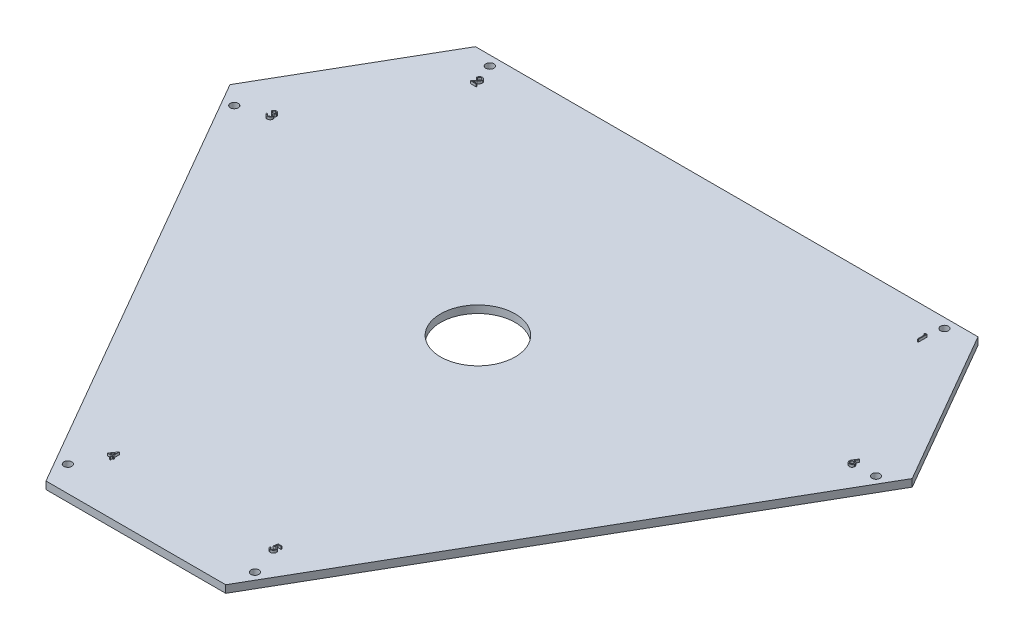
from build123d import *

# Parameters (mm, degrees)
SKETCH1_R           = 15
SKETCH1_R_2         = 1.6
BOSS_EXTRUDE1_DEPTH = 3
BOSS_EXTRUDE2_DEPTH = 1


with BuildPart() as part:
    # Sketch1 → Boss-Extrude1 (new body)
    with BuildSketch(Plane(origin=(0, 0, 0), x_dir=(1, 0, 0), z_dir=(0, 1, 0))):
        Polygon((100.985180782, 100), (-100.985180782, 100), (-137.095130769, 37.455731963), (-36.109949988, -137.455731963), (36.109949988, -137.455731963), (137.095130769, 37.455731963), align=None)
        with Locations(Location((0, 0, 0), (0, 0, 270))):
            Circle(SKETCH1_R, mode=Mode.SUBTRACT)
        with Locations(Location((91.352776846, 96.15, 0), (0, 0, 270))):
            Circle(SKETCH1_R_2, mode=Mode.SUBTRACT)
        with Locations(Location((128.944730997, 31.038825455, 0), (0, 0, 90))):
            Circle(SKETCH1_R_2, mode=Mode.SUBTRACT)
        with Locations(Location((37.591954151, -127.188825455, 0), (0, 0, 270))):
            Circle(SKETCH1_R_2, mode=Mode.SUBTRACT)
        with Locations(Location((-37.591954151, -127.188825455, 0), (0, 0, 90))):
            Circle(SKETCH1_R_2, mode=Mode.SUBTRACT)
        with Locations(Location((-128.944730997, 31.038825455, 0), (0, 0, 270))):
            Circle(SKETCH1_R_2, mode=Mode.SUBTRACT)
        with Locations(Location((-91.352776846, 96.15, 0), (0, 0, 90))):
            Circle(SKETCH1_R_2, mode=Mode.SUBTRACT)
    extrude(amount=BOSS_EXTRUDE1_DEPTH)

    # Sketch2 → Boss-Extrude2 (add)
    # profile 1 of 6: a face of its own
    with BuildSketch(Plane(origin=(0, 3, 0), x_dir=(1, 0, 0), z_dir=(0, 1, 0))):
        Polygon((90.231282455, 89.65), (90.878417872, 89.65), (90.878417872, 86.15), (90.564315308, 86.15), (90.564315308, 89.291025641), (90.025853769, 89.291025641), align=None)
    # profile 2 of 6: a face of its own
    with BuildSketch(Plane(origin=(0, 3, 0), x_dir=(1, 0, 0), z_dir=(0, 1, 0))):
        with BuildLine():
            Line((-88.769443513, 88.573076923), (-89.083546077, 88.573076923))
            add(Edge.make_bspline(
                [(-89.083546077, 88.573076923), (-89.081498924, 88.614747811), (-89.07747837, 88.696588325), (-89.058650081, 88.815912232), (-89.031709204, 88.929967031), (-88.99361775, 89.037836945), (-88.946311472, 89.140475752), (-88.889581444, 89.237475767), (-88.822387594, 89.328466956), (-88.74618086, 89.412605799), (-88.663412221, 89.48979337), (-88.574106281, 89.556448613), (-88.480261254, 89.612766284), (-88.382161855, 89.659847526), (-88.278701291, 89.695187372), (-88.170818434, 89.721409012), (-88.058039297, 89.737185357), (-87.981199275, 89.738881143), (-87.942119795, 89.73974359)],
                knots=[0, 0, 0, 0, 1.10065271, 2.161652631, 3.183658789, 4.190468796, 5.17591951, 6.163126047, 7.15150782, 8.156236427, 9.156009102, 10.134482811, 11.092018607, 12.041330605, 13.001268258, 13.972401359, 14.968799086, 16, 16, 16, 16], degree=3))
            add(Edge.make_bspline(
                [(-87.942119795, 89.73974359), (-87.903741721, 89.738845133), (-87.828330176, 89.737079698), (-87.718268162, 89.721918669), (-87.613490867, 89.698173078), (-87.514203101, 89.664857661), (-87.421197036, 89.620073234), (-87.333773992, 89.566275695), (-87.250893181, 89.504055864), (-87.176286397, 89.43080205), (-87.107778318, 89.352599666), (-87.048676063, 89.269111762), (-86.998062899, 89.182882477), (-86.95587522, 89.093254275), (-86.924819081, 88.999383247), (-86.901240873, 88.902636044), (-86.887913459, 88.802011233), (-86.885868035, 88.733904677), (-86.884828128, 88.699278846)],
                knots=[0, 0, 0, 0, 1.111607364, 2.184268762, 3.212621178, 4.221274766, 5.211760367, 6.196651075, 7.1921475, 8.207485113, 9.220403448, 10.201281604, 11.166441695, 12.114753415, 13.065576456, 14.026450734, 14.996634279, 16, 16, 16, 16], degree=3))
            add(Edge.make_bspline(
                [(-86.884828128, 88.699278846), (-86.886521391, 88.650531012), (-86.889878203, 88.553890798), (-86.918592579, 88.411875935), (-86.96343909, 88.274282516), (-87.017436447, 88.163545214), (-87.071908891, 88.07431172), (-87.120996399, 88.000843015), (-87.17846121, 87.921737547), (-87.245139708, 87.83726021), (-87.31965258, 87.746749304), (-87.402674743, 87.650259509), (-87.494798225, 87.548787739), (-87.559456726, 87.479482138), (-87.592961141, 87.443569712)],
                knots=[0, 0, 0, 0, 1.184426356, 2.348067706, 3.509069118, 4.696110526, 5.333549288, 6.050745305, 6.844228056, 7.710549037, 8.667450064, 9.695053472, 10.805634456, 12, 12, 12, 12], degree=3))
            Line((-87.592961141, 87.443569712), (-88.468662263, 86.508974359))
            Line((-88.468662263, 86.508974359), (-86.839956333, 86.508974359))
            Line((-86.839956333, 86.508974359), (-86.839956333, 86.15))
            Line((-86.839956333, 86.15), (-89.218161462, 86.15))
            Line((-89.218161462, 86.15), (-87.860789667, 87.598517628))
            add(Edge.make_bspline(
                [(-87.860789667, 87.598517628), (-87.82774178, 87.633015935), (-87.764263553, 87.699280121), (-87.674480976, 87.796023081), (-87.593841988, 87.885772622), (-87.521824595, 87.968359171), (-87.45999109, 88.044990738), (-87.405118858, 88.113185442), (-87.361153267, 88.175939892), (-87.313437871, 88.248680506), (-87.26722389, 88.337492823), (-87.227511534, 88.446026513), (-87.203296685, 88.557753765), (-87.20039185, 88.633255802), (-87.198930692, 88.671233974)],
                knots=[0, 0, 0, 0, 1.329631726, 2.553950428, 3.673215718, 4.687767853, 5.603093632, 6.413772471, 7.123043292, 7.734684054, 8.834405432, 9.900288307, 10.943827018, 12, 12, 12, 12], degree=3))
            add(Edge.make_bspline(
                [(-87.198930692, 88.671233974), (-87.199566435, 88.695115373), (-87.200819361, 88.742181023), (-87.211877058, 88.811186782), (-87.228587564, 88.877751596), (-87.252532822, 88.942080215), (-87.284139562, 89.003525867), (-87.322612942, 89.062163347), (-87.367003006, 89.118852313), (-87.418354275, 89.172005611), (-87.474765795, 89.220686816), (-87.534360044, 89.263810902), (-87.597410149, 89.299850012), (-87.663650271, 89.329393509), (-87.73289574, 89.352568891), (-87.805280485, 89.36862747), (-87.880604502, 89.378709954), (-87.932037997, 89.380074126), (-87.958245596, 89.380769231)],
                knots=[0, 0, 0, 0, 0.991446411, 1.95395049, 2.89581595, 3.838931463, 4.798493298, 5.75982156, 6.748411868, 7.785213223, 8.824556874, 9.840280684, 10.836137867, 11.835679398, 12.848801643, 13.863922112, 14.911575587, 16, 16, 16, 16], degree=3))
            add(Edge.make_bspline(
                [(-87.958245596, 89.380769231), (-87.985616429, 89.380054199), (-88.039368225, 89.378649993), (-88.118287258, 89.368827329), (-88.193573036, 89.351881489), (-88.265414939, 89.328704814), (-88.333934524, 89.299246266), (-88.398798569, 89.262554521), (-88.459861458, 89.218771028), (-88.517237981, 89.169130471), (-88.57010196, 89.11386287), (-88.616548836, 89.052252907), (-88.65713285, 88.985425492), (-88.692542084, 88.913560941), (-88.721297774, 88.836007161), (-88.743270924, 88.753039456), (-88.760657771, 88.665018075), (-88.766466292, 88.60423299), (-88.769443513, 88.573076923)],
                knots=[0, 0, 0, 0, 1.031018746, 2.02475058, 2.990194455, 3.934040569, 4.864654155, 5.795059489, 6.735614925, 7.690564532, 8.649604399, 9.611025574, 10.590972636, 11.591080095, 12.624614302, 13.701020113, 14.821632451, 16, 16, 16, 16], degree=3))
        make_face()
    # profile 3 of 6: a face of its own
    with BuildSketch(Plane(origin=(0, 3, 0), x_dir=(1, 0, 0), z_dir=(0, 1, 0))):
        with BuildLine():
            Line((-118.361397664, 35.731133147), (-118.675500228, 35.731133147))
            add(Edge.make_bspline(
                [(-118.675500228, 35.731133147), (-118.666990677, 35.766365631), (-118.650355202, 35.835242256), (-118.615657628, 35.933649517), (-118.577858373, 36.026773038), (-118.532469268, 36.112869112), (-118.482960514, 36.193668014), (-118.426237793, 36.267337139), (-118.36491807, 36.335750104), (-118.297093121, 36.396463342), (-118.225964459, 36.451441071), (-118.150529839, 36.498316129), (-118.072306946, 36.538640281), (-117.990753813, 36.571860513), (-117.905627641, 36.596886037), (-117.817698018, 36.615042842), (-117.726734518, 36.626833957), (-117.664986927, 36.62798472), (-117.633633241, 36.628569045)],
                knots=[0, 0, 0, 0, 1.162005537, 2.271625781, 3.343758855, 4.383309926, 5.390229558, 6.379919256, 7.361854164, 8.333198761, 9.295911338, 10.242430842, 11.177959212, 12.116337295, 13.062827104, 14.020064771, 14.994644689, 16, 16, 16, 16], degree=3))
            add(Edge.make_bspline(
                [(-117.633633241, 36.628569045), (-117.587950499, 36.627189815), (-117.497581488, 36.624461439), (-117.364818441, 36.599547003), (-117.236791622, 36.56012187), (-117.114902374, 36.505648143), (-117.001683941, 36.43846083), (-116.900947754, 36.358496093), (-116.814059244, 36.267296792), (-116.741164866, 36.166564227), (-116.684089867, 36.058908718), (-116.642003493, 35.948108561), (-116.616381812, 35.834426589), (-116.613061256, 35.75766931), (-116.611397664, 35.719214077)],
                knots=[0, 0, 0, 0, 1.083050992, 2.142477498, 3.193116406, 4.255571735, 5.30263384, 6.308962982, 7.297363603, 8.282367274, 9.249857812, 10.179914175, 11.08814088, 12, 12, 12, 12], degree=3))
            add(Edge.make_bspline(
                [(-116.611397664, 35.719214077), (-116.612561255, 35.682207282), (-116.614838222, 35.609790728), (-116.634171927, 35.504069231), (-116.66670819, 35.40442763), (-116.711777953, 35.310446468), (-116.770119503, 35.222721628), (-116.8407922, 35.141055738), (-116.924294862, 35.065086579), (-116.9875738, 35.021567106), (-117.02015167, 34.999161994)],
                knots=[0, 0, 0, 0, 1.024540389, 2.004866551, 2.965041327, 3.920577974, 4.882998113, 5.874504559, 6.905732034, 8, 8, 8, 8], degree=3))
            add(Edge.make_bspline(
                [(-117.02015167, 34.999161994), (-116.982919916, 34.981183822), (-116.909153041, 34.945563864), (-116.808602512, 34.875708107), (-116.717324636, 34.79505176), (-116.666420917, 34.732109107), (-116.640844779, 34.700484109)],
                knots=[0, 0, 0, 0, 1.015518401, 2.012035669, 3.001164323, 4, 4, 4, 4], degree=3))
            add(Edge.make_bspline(
                [(-116.640844779, 34.700484109), (-116.624003437, 34.677426357), (-116.590596541, 34.631688441), (-116.549361007, 34.558152015), (-116.511951893, 34.483800526), (-116.482801673, 34.40664112), (-116.460227806, 34.327568106), (-116.444091774, 34.24644571), (-116.434067633, 34.163207687), (-116.432632081, 34.106895207), (-116.431910484, 34.078589077)],
                knots=[0, 0, 0, 0, 1.025084078, 2.033381695, 3.024893161, 4.013698104, 4.991890475, 5.976764909, 6.982997093, 8, 8, 8, 8], degree=3))
            add(Edge.make_bspline(
                [(-116.431910484, 34.078589077), (-116.433704998, 34.029579356), (-116.43728558, 33.931790554), (-116.469289654, 33.787315832), (-116.518902895, 33.64609033), (-116.589359831, 33.511015491), (-116.67522734, 33.38463511), (-116.777384664, 33.271558801), (-116.894671072, 33.174360196), (-117.025476721, 33.093149968), (-117.167193849, 33.028232046), (-117.318769441, 32.983174603), (-117.478019495, 32.953828604), (-117.587226793, 32.950681735), (-117.642747824, 32.949081865)],
                knots=[0, 0, 0, 0, 0.955779014, 1.907060117, 2.875433937, 3.871313158, 4.872415639, 5.851225146, 6.836215519, 7.83643374, 8.849228613, 9.86973379, 10.916971861, 12, 12, 12, 12], degree=3))
            add(Edge.make_bspline(
                [(-117.642747824, 32.949081865), (-117.680167124, 32.949950079), (-117.753795829, 32.951658433), (-117.862039328, 32.963337034), (-117.965361027, 32.984667039), (-118.063900625, 33.013370345), (-118.157745661, 33.049762087), (-118.246609766, 33.095080785), (-118.33103966, 33.148392287), (-118.410238611, 33.210325875), (-118.484197179, 33.279607214), (-118.550949903, 33.357466224), (-118.611609696, 33.442463628), (-118.664552335, 33.535586684), (-118.712189287, 33.635631942), (-118.751370244, 33.74388044), (-118.785855813, 33.859364462), (-118.801889277, 33.939842202), (-118.810115612, 33.981133147)],
                knots=[0, 0, 0, 0, 1.048658725, 2.063410685, 3.046034179, 4.001477787, 4.936774919, 5.862367409, 6.792675028, 7.730719943, 8.675894397, 9.627829632, 10.600096036, 11.597688215, 12.626045268, 13.701542398, 14.82072376, 16, 16, 16, 16], degree=3))
            Line((-118.810115612, 33.981133147), (-118.496013048, 33.981133147))
            add(Edge.make_bspline(
                [(-118.496013048, 33.981133147), (-118.487829757, 33.954184134), (-118.471912544, 33.901765963), (-118.444818246, 33.826325657), (-118.413949974, 33.757167604), (-118.380835415, 33.693784482), (-118.346056969, 33.635552079), (-118.307142044, 33.58401021), (-118.266972899, 33.536895008), (-118.236693546, 33.510350396), (-118.221874426, 33.497359109)],
                knots=[0, 0, 0, 0, 1.198163088, 2.33053128, 3.407730985, 4.417276592, 5.372219308, 6.28897303, 7.162600585, 8, 8, 8, 8], degree=3))
            add(Edge.make_bspline(
                [(-118.221874426, 33.497359109), (-118.20227785, 33.482250775), (-118.163145187, 33.452080743), (-118.099376956, 33.413579115), (-118.03231207, 33.380218089), (-117.960497396, 33.354734394), (-117.885482625, 33.333156733), (-117.80605526, 33.319036214), (-117.722916043, 33.309348042), (-117.666148279, 33.308493111), (-117.63713885, 33.308056224)],
                knots=[0, 0, 0, 0, 0.946170439, 1.889420265, 2.845303464, 3.807233317, 4.801018734, 5.828864929, 6.890507805, 8, 8, 8, 8], degree=3))
            add(Edge.make_bspline(
                [(-117.63713885, 33.308056224), (-117.604385347, 33.30867213), (-117.5403387, 33.309876479), (-117.446883841, 33.320952186), (-117.357976393, 33.337082599), (-117.274603467, 33.361995582), (-117.19567296, 33.392776434), (-117.12229131, 33.431424839), (-117.053495204, 33.476769561), (-116.990165799, 33.528308719), (-116.933220291, 33.584730215), (-116.883080778, 33.643743286), (-116.840456117, 33.705099115), (-116.806072538, 33.769137236), (-116.778921988, 33.835592465), (-116.760438787, 33.904651294), (-116.747587272, 33.97574856), (-116.74654066, 34.024077529), (-116.746013048, 34.04844084)],
                knots=[0, 0, 0, 0, 1.217147791, 2.380027433, 3.494444702, 4.572153297, 5.609568379, 6.639424714, 7.649109417, 8.668170816, 9.669597737, 10.625200337, 11.543417969, 12.441394052, 13.322311151, 14.205496177, 15.095365482, 16, 16, 16, 16], degree=3))
            add(Edge.make_bspline(
                [(-116.746013048, 34.04844084), (-116.74754335, 34.081052179), (-116.750596338, 34.146112587), (-116.773904918, 34.241830161), (-116.812243782, 34.334053574), (-116.865916293, 34.421209364), (-116.931252022, 34.501985265), (-117.007616929, 34.574056748), (-117.095645157, 34.633526839), (-117.176665026, 34.674615495), (-117.248430183, 34.70265257), (-117.309845567, 34.721327535), (-117.37860217, 34.73714119), (-117.453868519, 34.751853462), (-117.536211736, 34.76437481), (-117.625542174, 34.774816626), (-117.721877935, 34.783171667), (-117.788569101, 34.786902762), (-117.822936125, 34.788825455)],
                knots=[0, 0, 0, 0, 1.07054697, 2.135767047, 3.216561865, 4.33974944, 5.486079747, 6.621378074, 7.775625952, 8.963672916, 9.598146892, 10.304877434, 11.070270905, 11.915000392, 12.823868403, 13.805723172, 14.86925407, 16, 16, 16, 16], degree=3))
            Line((-117.822936125, 34.788825455), (-117.822936125, 35.147799814))
            add(Edge.make_bspline(
                [(-117.822936125, 35.147799814), (-117.779634959, 35.148534618), (-117.694818613, 35.149973918), (-117.570924308, 35.167381928), (-117.452450996, 35.191462556), (-117.342024254, 35.228347749), (-117.241375541, 35.271188045), (-117.154055939, 35.321040255), (-117.081288791, 35.376455004), (-117.02342772, 35.438287613), (-116.979898491, 35.504602661), (-116.948071694, 35.573719319), (-116.929271368, 35.64624338), (-116.926761701, 35.695738048), (-116.925500228, 35.720616321)],
                knots=[0, 0, 0, 0, 1.321986639, 2.589447074, 3.816329219, 5.01088745, 6.139805852, 7.153945165, 8.075214402, 8.924034688, 9.728124013, 10.488707548, 11.240355623, 12, 12, 12, 12], degree=3))
            add(Edge.make_bspline(
                [(-116.925500228, 35.720616321), (-116.925914639, 35.738894066), (-116.92673909, 35.775256773), (-116.937136367, 35.828381841), (-116.952760408, 35.879882787), (-116.974240138, 35.929540598), (-117.002990336, 35.977010872), (-117.037396323, 36.02269832), (-117.078364423, 36.066342099), (-117.12530987, 36.107022419), (-117.175721675, 36.145791656), (-117.23097145, 36.178705293), (-117.289393325, 36.206850355), (-117.35105198, 36.230059857), (-117.41614751, 36.247519146), (-117.484374068, 36.260054987), (-117.555861751, 36.267892642), (-117.604633483, 36.269021058), (-117.62942651, 36.269594686)],
                knots=[0, 0, 0, 0, 0.884392785, 1.759457502, 2.611959086, 3.489218968, 4.37281399, 5.2945488, 6.255912374, 7.266815255, 8.301784654, 9.332968512, 10.37626691, 11.440494194, 12.520033166, 13.637162961, 14.798855837, 16, 16, 16, 16], degree=3))
            add(Edge.make_bspline(
                [(-117.62942651, 36.269594686), (-117.669278178, 36.268203324), (-117.747117754, 36.26548567), (-117.859332671, 36.241682657), (-117.963652005, 36.203704573), (-118.043390672, 36.158371554), (-118.102273246, 36.11362112), (-118.144350184, 36.074538734), (-118.185670694, 36.03110591), (-118.223516371, 35.980647535), (-118.261790348, 35.926580745), (-118.29663491, 35.866157063), (-118.330494602, 35.800952669), (-118.350897151, 35.754857034), (-118.361397664, 35.731133147)],
                knots=[0, 0, 0, 0, 1.472543308, 2.876219568, 4.221790263, 5.565193594, 6.249813518, 6.953379497, 7.687249741, 8.463570142, 9.283606569, 10.136032583, 11.040678096, 12, 12, 12, 12], degree=3))
        make_face()
    # profile 4 of 6: a face of its own
    with BuildSketch(Plane(origin=(0, 3, 0), x_dir=(1, 0, 0), z_dir=(0, 1, 0))):
        Polygon((-30.546781875, -113.599081865), (-30.482979792, -113.599081865), (-30.482979792, -116.022158788), (-30.079133638, -116.022158788), (-30.079133638, -116.381133147), (-30.482979792, -116.381133147), (-30.482979792, -117.188825455), (-30.797082356, -117.188825455), (-30.797082356, -116.381133147), (-32.457338766, -116.381133147), align=None)
        Polygon((-30.797082356, -116.022158788), (-30.797082356, -114.502126737), (-31.840351587, -116.022158788), align=None, mode=Mode.SUBTRACT)
    # profile 5 of 6: a face of its own
    with BuildSketch(Plane(origin=(0, 3, 0), x_dir=(1, 0, 0), z_dir=(0, 1, 0))):
        with BuildLine():
            Line((34.925287484, -113.688825455), (34.925287484, -114.047799814))
            Line((34.925287484, -114.047799814), (33.734782676, -114.047799814))
            Line((33.734782676, -114.047799814), (33.546180914, -114.968372731))
            add(Edge.make_bspline(
                [(33.546180914, -114.968372731), (33.583236788, -114.958142459), (33.655026684, -114.938322925), (33.760986545, -114.916317155), (33.861578748, -114.903051711), (33.926854119, -114.9012404), (33.958440529, -114.900363917)],
                knots=[0, 0, 0, 0, 1.100273476, 2.13160584, 3.095893838, 4, 4, 4, 4], degree=3))
            add(Edge.make_bspline(
                [(33.958440529, -114.900363917), (33.997524269, -114.901209852), (34.074372666, -114.902873173), (34.186811613, -114.918845023), (34.294144506, -114.943984937), (34.396146876, -114.979105459), (34.493007427, -115.024015192), (34.583834988, -115.080115133), (34.669992901, -115.145648464), (34.749935495, -115.220993476), (34.822459804, -115.303915093), (34.886225793, -115.393072964), (34.940388384, -115.487600626), (34.983949138, -115.588401234), (35.018733473, -115.694360388), (35.041885468, -115.80659297), (35.057302177, -115.92404109), (35.059024563, -116.00434566), (35.059902869, -116.045295808)],
                knots=[0, 0, 0, 0, 1.052922333, 2.070308379, 3.05430497, 4.020497103, 4.973039431, 5.925935799, 6.892292201, 7.88610001, 8.88166317, 9.857072816, 10.836096531, 11.812156883, 12.81219415, 13.836441305, 14.89672472, 16, 16, 16, 16], degree=3))
            add(Edge.make_bspline(
                [(35.059902869, -116.045295808), (35.059237793, -116.073818028), (35.057916631, -116.130477016), (35.051198043, -116.214621216), (35.038262327, -116.296984049), (35.020894603, -116.377576441), (34.998352185, -116.456245813), (34.971063131, -116.533217341), (34.937667104, -116.608011948), (34.901035728, -116.681337343), (34.85978925, -116.75153585), (34.814010743, -116.817184837), (34.765645252, -116.879269118), (34.713603866, -116.937122851), (34.657402871, -116.990365869), (34.597722904, -117.039314151), (34.535040185, -117.084795481), (34.468384943, -117.124963676), (34.39924246, -117.161926632), (34.326614243, -117.19225017), (34.252153542, -117.219360698), (34.174788667, -117.240970225), (34.094694854, -117.25790278), (34.011740079, -117.269403381), (33.926359409, -117.277779818), (33.868484396, -117.278304175), (33.839249824, -117.278569045)],
                knots=[0, 0, 0, 0, 1.056347294, 2.098418968, 3.122841568, 4.141288669, 5.149314143, 6.15115421, 7.162517403, 8.180376062, 9.185164535, 10.17417709, 11.141909838, 12.097768115, 13.052685741, 14.0056014, 14.954263652, 15.917497458, 16.885230207, 17.854509472, 18.828990115, 19.81800267, 20.826176721, 21.857883937, 22.917946725, 24, 24, 24, 24], degree=3))
            add(Edge.make_bspline(
                [(33.839249824, -117.278569045), (33.804375643, -117.277878207), (33.735764812, -117.276519065), (33.635244245, -117.26230058), (33.53852964, -117.241936663), (33.446399538, -117.211300393), (33.358028275, -117.172913099), (33.274605557, -117.124396927), (33.193999781, -117.069417823), (33.119487744, -117.00453747), (33.050331631, -116.933621788), (32.988425122, -116.856664147), (32.933291545, -116.774934705), (32.885813798, -116.688036551), (32.845315777, -116.59619802), (32.813500789, -116.499075019), (32.787822434, -116.397175015), (32.776959013, -116.327021505), (32.77144133, -116.291389558)],
                knots=[0, 0, 0, 0, 1.0467383, 2.05933395, 3.04377827, 4.011590433, 4.970194871, 5.932262533, 6.905835911, 7.896367577, 8.894135286, 9.877477877, 10.858688626, 11.851381753, 12.8477658, 13.868841284, 14.917554742, 16, 16, 16, 16], degree=3))
            Line((32.77144133, -116.291389558), (33.085543894, -116.291389558))
            add(Edge.make_bspline(
                [(33.085543894, -116.291389558), (33.093272452, -116.32476601), (33.108127168, -116.388917405), (33.140732917, -116.479048746), (33.180598792, -116.55936797), (33.228003141, -116.630937553), (33.284553171, -116.693346551), (33.3490826, -116.748963612), (33.421430323, -116.799138742), (33.501823553, -116.840961509), (33.586636632, -116.876630262), (33.675403842, -116.900381957), (33.765708189, -116.91708285), (33.826786559, -116.918754611), (33.85747899, -116.919594686)],
                knots=[0, 0, 0, 0, 1.136247022, 2.183929868, 3.172523383, 4.106158343, 5.02341133, 5.958108904, 6.928429099, 7.938127109, 8.96079061, 9.975095812, 10.982467395, 12, 12, 12, 12], degree=3))
            add(Edge.make_bspline(
                [(33.85747899, -116.919594686), (33.887437435, -116.918773908), (33.946425857, -116.91715779), (34.033237244, -116.904718777), (34.117050118, -116.885561206), (34.197037475, -116.856891351), (34.274599014, -116.822046633), (34.347772785, -116.777331557), (34.418675662, -116.725871539), (34.485103795, -116.666914908), (34.545943245, -116.601945214), (34.599699366, -116.53246782), (34.644476279, -116.458350974), (34.682210388, -116.380877821), (34.710863687, -116.299199264), (34.731304668, -116.213698089), (34.743307727, -116.124163108), (34.744958907, -116.063093799), (34.745800305, -116.031974494)],
                knots=[0, 0, 0, 0, 1.027316725, 2.022795036, 3.002884548, 3.971462791, 4.93288096, 5.914575861, 6.907176829, 7.935150275, 8.956128384, 9.956726525, 10.942570165, 11.921478529, 12.907843606, 13.90538589, 14.932640048, 16, 16, 16, 16], degree=3))
            add(Edge.make_bspline(
                [(34.745800305, -116.031974494), (34.745141825, -116.003898742), (34.743852945, -115.948944453), (34.733322375, -115.868545246), (34.715005403, -115.792472204), (34.689581523, -115.72035797), (34.657302015, -115.652134528), (34.617855703, -115.587731468), (34.570502305, -115.527997634), (34.516410416, -115.472905081), (34.457152375, -115.422060206), (34.391708633, -115.378716119), (34.321448706, -115.342252202), (34.247219106, -115.310784203), (34.167254208, -115.288183458), (34.083137575, -115.271215573), (33.993960867, -115.26140021), (33.932990179, -115.260038322), (33.901649664, -115.259338276)],
                knots=[0, 0, 0, 0, 1.045622112, 2.046656509, 3.013763289, 3.955457236, 4.890082067, 5.820317437, 6.762574623, 7.722996705, 8.69280354, 9.665887285, 10.63943826, 11.638615906, 12.663482002, 13.728887084, 14.832589034, 16, 16, 16, 16], degree=3))
            add(Edge.make_bspline(
                [(33.901649664, -115.259338276), (33.874520735, -115.259918867), (33.818506379, -115.26111764), (33.732583553, -115.269944137), (33.64229183, -115.284183431), (33.547977334, -115.303769679), (33.449356826, -115.329400756), (33.346638425, -115.360115256), (33.239606159, -115.396837255), (33.167488434, -115.424569469), (33.130415689, -115.438825455)],
                knots=[0, 0, 0, 0, 0.817624296, 1.688186739, 2.600797293, 3.572016777, 4.590301741, 5.671205678, 6.80286297, 8, 8, 8, 8], degree=3))
            Line((33.130415689, -115.438825455), (33.489390048, -113.688825455))
            Line((33.489390048, -113.688825455), (34.925287484, -113.688825455))
        make_face()
    # profile 6 of 6: a face of its own
    with BuildSketch(Plane(origin=(0, 3, 0), x_dir=(1, 0, 0), z_dir=(0, 1, 0))):
        with BuildLine():
            Line((120.694730997, 32.628569045), (120.936618016, 32.438565038))
            Line((120.936618016, 32.438565038), (120.011838369, 31.024402378))
            add(Edge.make_bspline(
                [(120.011838369, 31.024402378), (120.073408646, 31.034216239), (120.193508433, 31.053359284), (120.315074331, 31.056517229), (120.374318337, 31.058056224)],
                knots=[0, 0, 0, 0, 1.025318673, 2, 2, 2, 2], degree=3))
            add(Edge.make_bspline(
                [(120.374318337, 31.058056224), (120.409890833, 31.057100113), (120.479914234, 31.055218035), (120.582721036, 31.040734185), (120.681509972, 31.017909073), (120.775871584, 30.984636817), (120.866144566, 30.942134462), (120.952846962, 30.891195592), (121.034348972, 30.829189912), (121.111700151, 30.759924956), (121.181927249, 30.683207971), (121.244103304, 30.601806635), (121.296330096, 30.515805754), (121.338704018, 30.425248888), (121.371608896, 30.330275628), (121.395596541, 30.231007489), (121.409776134, 30.127376017), (121.411701625, 30.056897842), (121.412679715, 30.02109709)],
                knots=[0, 0, 0, 0, 1.04369286, 2.054478336, 3.041073146, 4.015093852, 4.984733326, 5.965804835, 6.960378782, 7.985147595, 9.009457201, 10.008161701, 10.986880575, 11.956520048, 12.937015923, 13.931873656, 14.949455224, 16, 16, 16, 16], degree=3))
            add(Edge.make_bspline(
                [(121.412679715, 30.02109709), (121.41125661, 29.972117386), (121.408456276, 29.87573692), (121.38055248, 29.735360213), (121.337192836, 29.601627698), (121.275215307, 29.476674527), (121.198232924, 29.360671957), (121.104355332, 29.257886492), (120.996911843, 29.166216454), (120.875425045, 29.089559835), (120.744682081, 29.026956784), (120.607330084, 28.981991542), (120.464702937, 28.954308073), (120.367898329, 28.95083747), (120.318929715, 28.949081865)],
                knots=[0, 0, 0, 0, 1.031375318, 2.029502543, 3.004789286, 3.987476834, 4.960371455, 5.9300674, 6.912260825, 7.929083631, 8.949397511, 9.960523116, 10.96833055, 12, 12, 12, 12], degree=3))
            add(Edge.make_bspline(
                [(120.318929715, 28.949081865), (120.271833014, 28.950610071), (120.178542696, 28.953637179), (120.041309902, 28.980603117), (119.909446885, 29.02431022), (119.783877504, 29.084524498), (119.667556891, 29.160582381), (119.563491254, 29.25214466), (119.47219948, 29.357254125), (119.396224859, 29.475894473), (119.335966127, 29.60338443), (119.290776202, 29.736321587), (119.264379959, 29.874221568), (119.260691402, 29.967702708), (119.258833561, 30.014786994)],
                knots=[0, 0, 0, 0, 1.012016664, 2.004627821, 2.994792927, 3.992885782, 4.990978636, 5.973936114, 6.964471063, 7.975201453, 8.993600317, 9.990122807, 10.98767138, 12, 12, 12, 12], degree=3))
            add(Edge.make_bspline(
                [(119.258833561, 30.014786994), (119.260015006, 30.050831577), (119.262427291, 30.124427729), (119.279270681, 30.235891757), (119.306335476, 30.349942838), (119.336645723, 30.446697032), (119.368671333, 30.525958554), (119.395323872, 30.589862045), (119.428497868, 30.655623118), (119.463871249, 30.725496754), (119.504628118, 30.797682187), (119.548943768, 30.873385856), (119.598043419, 30.951403784), (119.632463581, 31.004347979), (119.650059523, 31.031413596)],
                knots=[0, 0, 0, 0, 1.173818275, 2.396712641, 3.66331629, 4.989737886, 5.693666774, 6.447286557, 7.243889047, 8.091586357, 8.998013824, 9.943181721, 10.948533338, 12, 12, 12, 12], degree=3))
            Line((119.650059523, 31.031413596), (120.694730997, 32.628569045))
        make_face()
        with BuildLine():
            add(Edge.make_bspline(
                [(120.308412888, 30.699081865), (120.281750643, 30.698303822), (120.229671534, 30.696784076), (120.153264119, 30.687958824), (120.080950868, 30.671339759), (120.011773734, 30.650173427), (119.947026031, 30.621070367), (119.886237191, 30.585718568), (119.829172139, 30.54409739), (119.776428588, 30.496796479), (119.728608924, 30.445008446), (119.687427793, 30.389538924), (119.651905393, 30.331724721), (119.623023575, 30.271082779), (119.600533499, 30.207636279), (119.584265248, 30.14167703), (119.575211497, 30.072762723), (119.573705265, 30.026030221), (119.572936125, 30.002166801)],
                knots=[0, 0, 0, 0, 1.129588631, 2.206414736, 3.251139165, 4.268635594, 5.265702196, 6.250456724, 7.242448911, 8.251968645, 9.246821453, 10.222880186, 11.173611482, 12.116736599, 13.062300278, 14.020270554, 14.989073742, 16, 16, 16, 16], degree=3))
            add(Edge.make_bspline(
                [(119.572936125, 30.002166801), (119.573562487, 29.978516821), (119.574790688, 29.932142732), (119.585943008, 29.863803552), (119.602978091, 29.798038644), (119.628318486, 29.735187045), (119.658545375, 29.674290727), (119.698450699, 29.617555441), (119.742667485, 29.561535371), (119.795521418, 29.5105339), (119.852244781, 29.463077276), (119.912845983, 29.421597022), (119.976005943, 29.386110849), (120.042577365, 29.358299751), (120.111615749, 29.335475464), (120.183696303, 29.319413985), (120.258869159, 29.310333459), (120.309791097, 29.308825265), (120.335756638, 29.308056224)],
                knots=[0, 0, 0, 0, 0.989467248, 1.94019797, 2.891935182, 3.827694429, 4.772920941, 5.730924762, 6.725747692, 7.756678648, 8.79901574, 9.819492441, 10.826891316, 11.826466727, 12.835195252, 13.867842842, 14.912794438, 16, 16, 16, 16], degree=3))
            add(Edge.make_bspline(
                [(120.335756638, 29.308056224), (120.361722137, 29.308825326), (120.412643991, 29.310333638), (120.487817451, 29.319413306), (120.55989577, 29.335477954), (120.628942279, 29.358290725), (120.69548371, 29.386144334), (120.758588431, 29.421376254), (120.818616525, 29.463332372), (120.875377124, 29.5104528), (120.928011063, 29.561825652), (120.973288341, 29.617055374), (121.011971575, 29.67474927), (121.043405762, 29.73494716), (121.068467053, 29.798076647), (121.08558852, 29.863793371), (121.096717809, 29.932145397), (121.097949175, 29.978517722), (121.098577151, 30.002166801)],
                knots=[0, 0, 0, 0, 1.087397944, 2.132534446, 3.165364764, 4.174271784, 5.174024072, 6.181601208, 7.194203697, 8.236725232, 9.267838612, 10.269026844, 11.221737037, 12.171628256, 13.107553087, 14.05945871, 15.010357665, 16, 16, 16, 16], degree=3))
            add(Edge.make_bspline(
                [(121.098577151, 30.002166801), (121.098026858, 30.026061352), (121.096946812, 30.072958585), (121.084730863, 30.141646203), (121.067788489, 30.207971409), (121.042205459, 30.271517358), (121.008968914, 30.332033285), (120.968485507, 30.389824886), (120.921652936, 30.445335234), (120.867555397, 30.496898042), (120.808665163, 30.54404512), (120.746049578, 30.585664676), (120.680541604, 30.620789653), (120.612207661, 30.650096755), (120.540264779, 30.671246229), (120.46587444, 30.687899473), (120.388085197, 30.69676149), (120.335308589, 30.698298555), (120.308412888, 30.699081865)],
                knots=[0, 0, 0, 0, 0.978206639, 1.919901502, 2.851605144, 3.780102724, 4.718870031, 5.675451981, 6.667674623, 7.690630536, 8.733308323, 9.756129687, 10.767539656, 11.776269907, 12.797430371, 13.836405707, 14.897401972, 16, 16, 16, 16], degree=3))
        make_face(mode=Mode.SUBTRACT)
    extrude(amount=BOSS_EXTRUDE2_DEPTH)


solid = part.part
